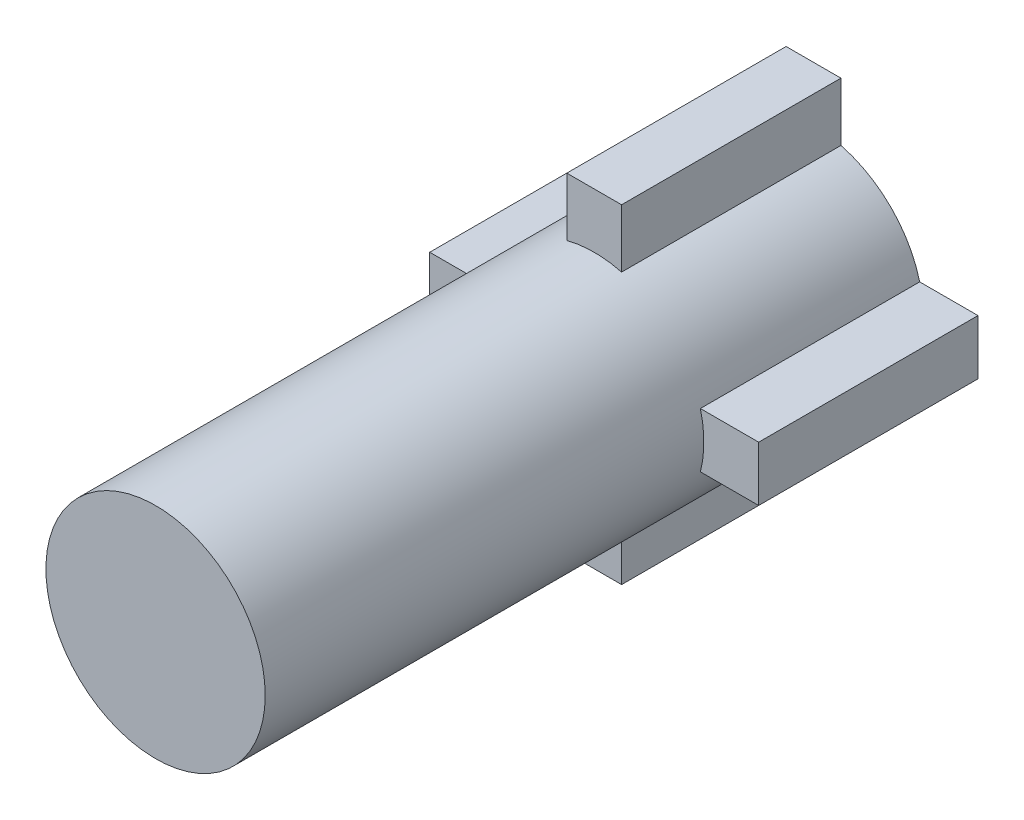
from build123d import *

# Parameters (mm, degrees)
SKETCH3_R           = 0.1
BOSS_EXTRUDE1_DEPTH = 0.3
SKETCH4_W           = 0.1
SKETCH4_H           = 0.05
SKETCH4_W_2         = 0.05
SKETCH4_H_2         = 0.1
BOSS_EXTRUDE2_DEPTH = 0.2


with BuildPart() as part:
    # Sketch3 → Boss-Extrude1 (new, symmetric)
    with BuildSketch(Plane.XY):
        Circle(SKETCH3_R)
    extrude(amount=BOSS_EXTRUDE1_DEPTH, both=True)

    # Sketch4 → Boss-Extrude2 (add)
    with BuildSketch(Plane(origin=(0, 0, -0.3), x_dir=(-1, 0, 0), z_dir=(0, 0, -1))):
        with Locations((-0.1, 0)):
            Rectangle(SKETCH4_W, SKETCH4_H)
        with Locations((0, 0.1)):
            Rectangle(SKETCH4_W_2, SKETCH4_H_2)
        with Locations((0.1, 0)):
            Rectangle(SKETCH4_W, SKETCH4_H)
        with Locations((0, -0.1)):
            Rectangle(SKETCH4_W_2, SKETCH4_H_2)
    extrude(amount=-BOSS_EXTRUDE2_DEPTH)


solid = part.part
